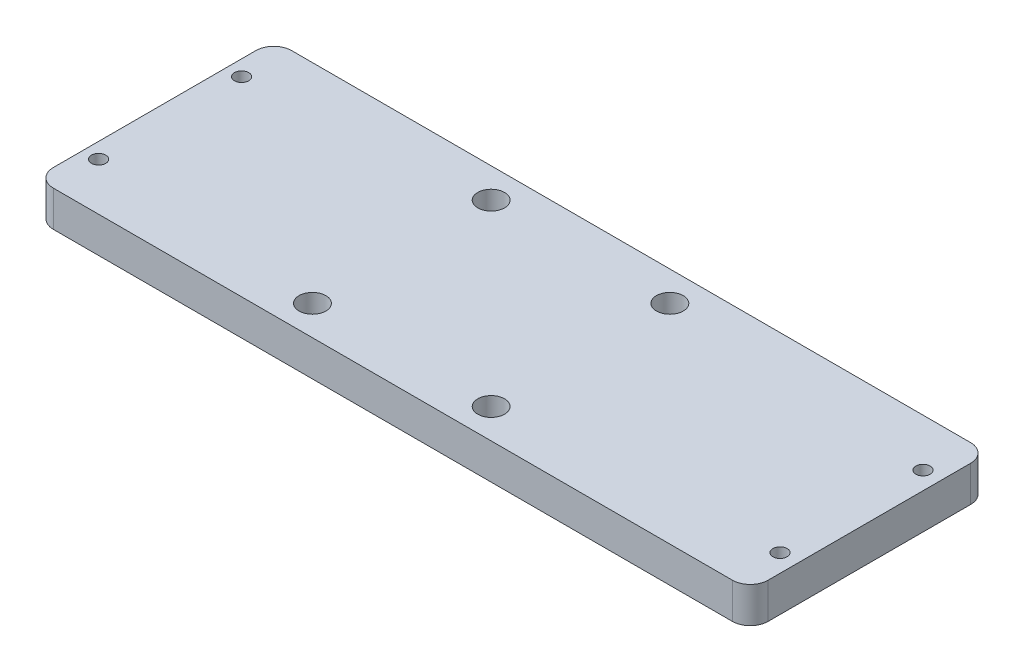
from build123d import *

# Parameters (mm, degrees)
SKETCH1_W           = 127
SKETCH1_H           = 40
SKETCH1_R           = 1.2
SKETCH1_R_2         = 2.25
BOSS_EXTRUDE1_DEPTH = 6
SKETCH2_W           = 40
SKETCH2_H           = 6
CUT_EXTRUDE1_DEPTH  = 7
FILLET1_R           = 3


with BuildPart() as part:
    # Sketch1 → Boss-Extrude1 (new body)
    with BuildSketch(Plane(origin=(0, 0, 0), x_dir=(1, 0, 0), z_dir=(0, 1, 0))):
        Rectangle(SKETCH1_W, SKETCH1_H)
        with Locations(Location((60.5, 12, 0), (0, 0, 270))):
            Circle(SKETCH1_R, mode=Mode.SUBTRACT)
        with Locations(Location((-53.9, 12, 0), (0, 0, 270))):
            Circle(SKETCH1_R, mode=Mode.SUBTRACT)
        with Locations(Location((-15, 15, 0), (0, 0, 270))):
            Circle(SKETCH1_R_2, mode=Mode.SUBTRACT)
        with Locations(Location((15, 15, 0), (0, 0, 90))):
            Circle(SKETCH1_R_2, mode=Mode.SUBTRACT)
        with Locations(Location((60.5, -12, 0), (0, 0, 90))):
            Circle(SKETCH1_R, mode=Mode.SUBTRACT)
        with Locations(Location((15, -15, 0), (0, 0, 270))):
            Circle(SKETCH1_R_2, mode=Mode.SUBTRACT)
        with Locations(Location((-15, -15, 0), (0, 0, 90))):
            Circle(SKETCH1_R_2, mode=Mode.SUBTRACT)
        with Locations(Location((-53.9, -12, 0), (0, 0, 90))):
            Circle(SKETCH1_R, mode=Mode.SUBTRACT)
    extrude(amount=BOSS_EXTRUDE1_DEPTH)

    # Sketch2 → Cut-Extrude1 (cut)
    with BuildSketch(Plane.ZY.offset(63.5)):
        with Locations((0, 3)):
            Rectangle(SKETCH2_W, SKETCH2_H)
    extrude(amount=-CUT_EXTRUDE1_DEPTH, mode=Mode.SUBTRACT)

    # Fillet1
    fillet1_edges = [part.edges().sort_by_distance(p)[0] for p in [
        (-56.5, 3, -20),
        (-56.5, 3, 20),
        (63.5, 3, 20),
        (63.5, 3, -20),
    ]]
    fillet(fillet1_edges, radius=FILLET1_R)


solid = part.part
